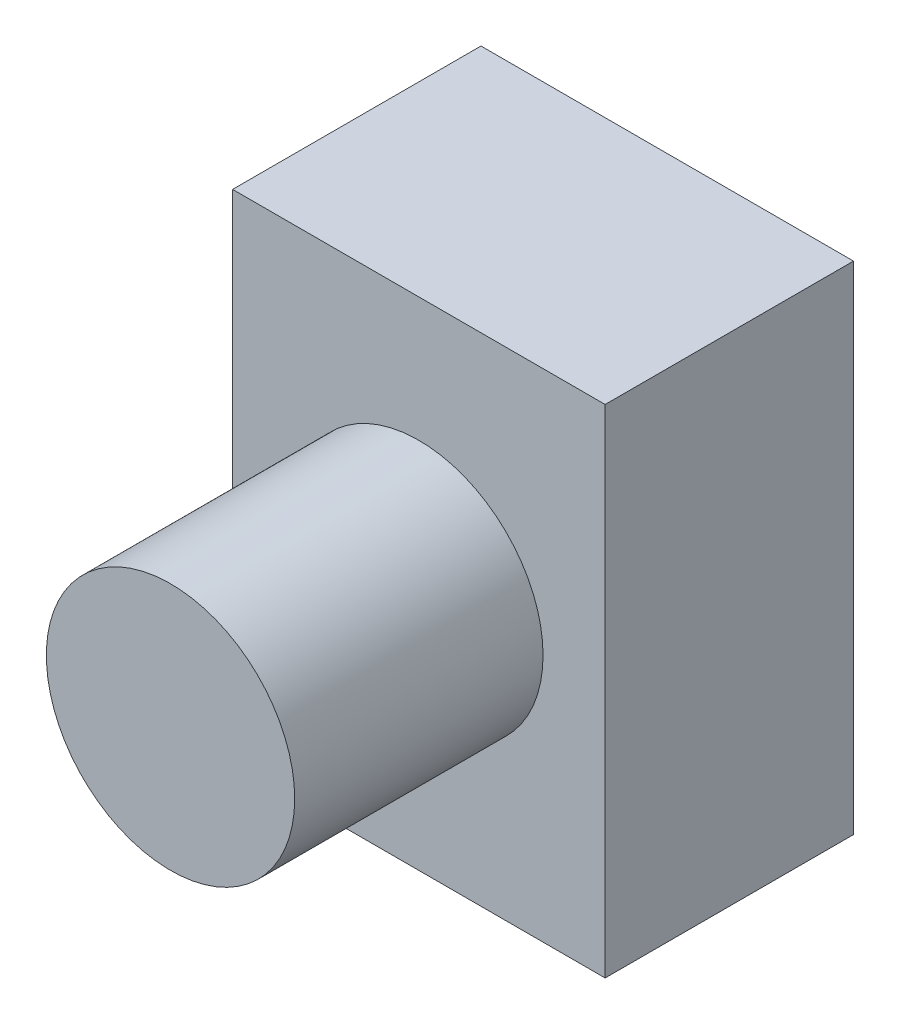
from build123d import *

# Parameters (mm, degrees)
SKETCH1_W           = 30
SKETCH1_H           = 40
BOSS_EXTRUDE1_DEPTH = 20
SKETCH2_R           = 10
BOSS_EXTRUDE2_DEPTH = 20


with BuildPart() as part:
    # Sketch1 → Boss-Extrude1 (new body)
    with BuildSketch(Plane.XY):
        Rectangle(SKETCH1_W, SKETCH1_H)
    extrude(amount=BOSS_EXTRUDE1_DEPTH)

    # Sketch2 → Boss-Extrude2 (add)
    with BuildSketch(Plane.XY.offset(20)):
        Circle(SKETCH2_R)
    extrude(amount=BOSS_EXTRUDE2_DEPTH)


solid = part.part
